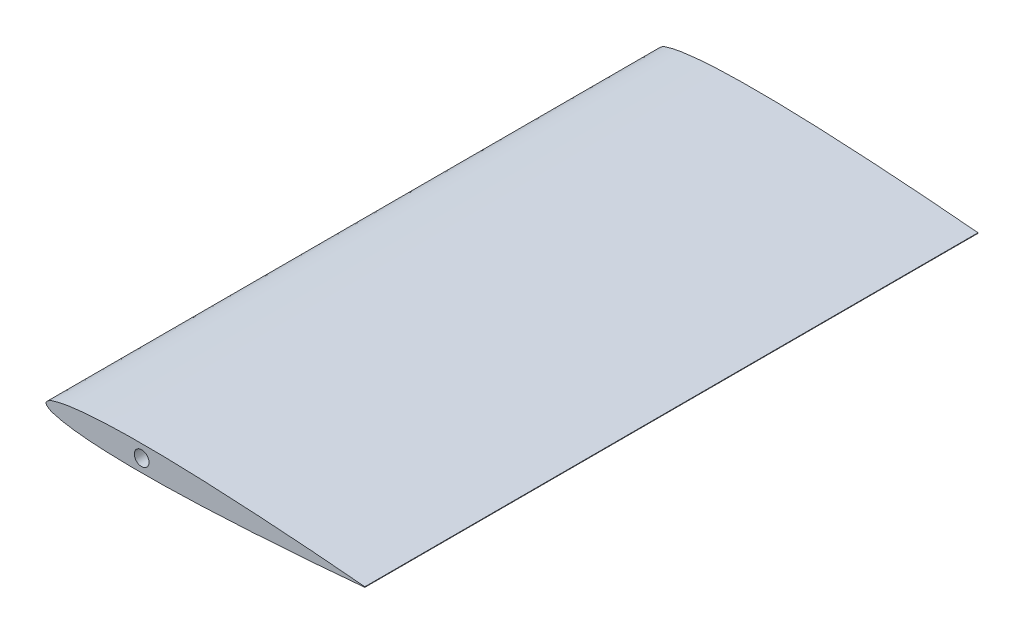
from build123d import *

# Parameters (mm, degrees)
SCHIZZO2_R                   = 3
ESTRUSIONE_ESTRUSIONE1_DEPTH = 250


with BuildPart() as part:
    # Schizzo2 → Estrusione-Estrusione1 (new body)
    with BuildSketch(Plane.XY):
        with BuildLine():
            Line((130, 0.1092), (130, -0.1092))
            add(Edge.make_bspline(
                [(130, 0.1092), (127.833535733, 0.30777396), (123.501553963, 0.704835103), (114.836215078, 1.44410928), (104.004308011, 2.293182201), (91.003887287, 3.195231803), (78.004031632, 3.980339539), (65.003916019, 4.618100454), (52.003385177, 5.0742838), (41.167039883, 5.232636155), (32.498919096, 5.169386992), (25.997069838, 4.99948673), (19.49138839, 4.669784925), (14.075370051, 4.208518196), (9.735785729, 3.658199851), (6.491603633, 3.125226199), (3.704548113, 2.428360256), (1.514995678, 1.717394523), (-0.863985461, 0), (1.514995678, -1.717394523), (3.704548113, -2.428360256), (6.491603633, -3.125226199), (9.735785729, -3.658199851), (14.075370051, -4.208518196), (19.49138839, -4.669784925), (25.997069838, -4.99948673), (32.498919096, -5.169386992), (41.167039883, -5.232636155), (52.003385177, -5.0742838), (65.003916019, -4.618100454), (78.004031632, -3.980339539), (91.003887287, -3.195231803), (104.004308011, -2.293182201), (114.836215078, -1.44410928), (123.501553963, -0.704835103), (127.833535733, -0.30777396), (130, -0.1092)],
                knots=[0, 0, 0, 0, 0.02487628, 0.04974169, 0.099443442, 0.149112186, 0.198750911, 0.248359047, 0.297937294, 0.347491197, 0.372266798, 0.397050686, 0.421859364, 0.446731256, 0.45922021, 0.47179016, 0.484560191, 0.491194846, 0.5, 0.508805154, 0.515439809, 0.52820984, 0.54077979, 0.553268744, 0.578140636, 0.602949314, 0.627733202, 0.652508803, 0.702062706, 0.751640953, 0.801249089, 0.850887814, 0.900556558, 0.95025831, 0.97512372, 1, 1, 1, 1], degree=3))
        make_face()
        with Locations((38.997256927, 0)):
            Circle(SCHIZZO2_R, mode=Mode.SUBTRACT)
    extrude(amount=ESTRUSIONE_ESTRUSIONE1_DEPTH)


solid = part.part
